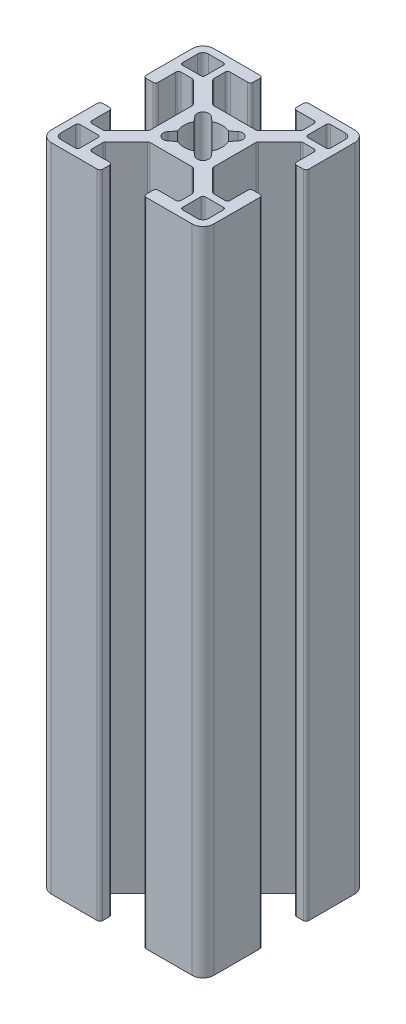
from build123d import *

# Parameters (mm, degrees)
PERFIL_COM_ALUMINIO_PERFIL_COMER_30_X_DEPTH = 120
DURCHGANGSLOCH_F_R_M51_D                    = 5.3
ESBO_O4_R                                   = 2.5
CORTE_EXTRUS_O1_DEPTH                       = 123.721924241


with BuildPart() as part:
    # Esboço1 → Perfil com. aluminio PERFIL COMER. 30 X 30(1) (new body)
    with BuildSketch(Plane(origin=(0, 0, 0), x_dir=(1, 0, 0), z_dir=(0, 1, 0))):
        with BuildLine():
            Line((0, 5.872725395), (-3.872893219, 5.872725395))
            ThreePointArc((-3.872893219, 5.872725395), (-4.064234935, 5.910785628), (-4.226446609, 6.019172004))
            Line((-4.226446609, 6.019172004), (-8.073553391, 9.866278785))
            ThreePointArc((-8.073553391, 9.866278785), (-8.181939766, 10.02849046), (-8.22, 10.219832176))
            Line((-8.22, 10.219832176), (-8.22, 12.25))
            ThreePointArc((-8.22, 12.25), (-8.073553391, 12.603553391), (-7.72, 12.75))
            Line((-7.72, 12.75), (-4.5, 12.75))
            ThreePointArc((-4.5, 12.75), (-4.146446609, 12.896446609), (-4, 13.25))
            Line((-4, 13.25), (-4, 14.5))
            ThreePointArc((-4, 14.5), (-4.146446609, 14.853553391), (-4.5, 15))
            Line((-4.5, 15), (-13, 15))
            ThreePointArc((-13, 15), (-14.414213562, 14.414213562), (-15, 13))
            Line((-15, 13), (-15, 4.5))
            ThreePointArc((-15, 4.5), (-14.853553391, 4.146446609), (-14.5, 4))
            Line((-14.5, 4), (-13.25, 4))
            ThreePointArc((-13.25, 4), (-12.896446609, 4.146446609), (-12.75, 4.5))
            Line((-12.75, 4.5), (-12.75, 7.72))
            ThreePointArc((-12.75, 7.72), (-12.603553391, 8.073553391), (-12.25, 8.22))
            Line((-12.25, 8.22), (-10.219832176, 8.22))
            ThreePointArc((-10.219832176, 8.22), (-10.02849046, 8.181939766), (-9.866278785, 8.073553391))
            Line((-9.866278785, 8.073553391), (-6.019172004, 4.226446609))
            ThreePointArc((-6.019172004, 4.226446609), (-5.910785628, 4.064234935), (-5.872725395, 3.872893219))
            Line((-5.872725395, 3.872893219), (-5.872725395, 0))
            Line((-5.872725395, 0), (-5.872725395, -3.872893219))
            ThreePointArc((-5.872725395, -3.872893219), (-5.910785628, -4.064234935), (-6.019172004, -4.226446609))
            Line((-6.019172004, -4.226446609), (-9.866278785, -8.073553391))
            ThreePointArc((-9.866278785, -8.073553391), (-10.02849046, -8.181939766), (-10.219832176, -8.22))
            Line((-10.219832176, -8.22), (-12.25, -8.22))
            ThreePointArc((-12.25, -8.22), (-12.603553391, -8.073553391), (-12.75, -7.72))
            Line((-12.75, -7.72), (-12.75, -4.5))
            ThreePointArc((-12.75, -4.5), (-12.896446609, -4.146446609), (-13.25, -4))
            Line((-13.25, -4), (-14.5, -4))
            ThreePointArc((-14.5, -4), (-14.853553391, -4.146446609), (-15, -4.5))
            Line((-15, -4.5), (-15, -13))
            ThreePointArc((-15, -13), (-14.414213562, -14.414213562), (-13, -15))
            Line((-13, -15), (-4.5, -15))
            ThreePointArc((-4.5, -15), (-4.146446609, -14.853553391), (-4, -14.5))
            Line((-4, -14.5), (-4, -13.25))
            ThreePointArc((-4, -13.25), (-4.146446609, -12.896446609), (-4.5, -12.75))
            Line((-4.5, -12.75), (-7.72, -12.75))
            ThreePointArc((-7.72, -12.75), (-8.073553391, -12.603553391), (-8.22, -12.25))
            Line((-8.22, -12.25), (-8.22, -10.219832176))
            ThreePointArc((-8.22, -10.219832176), (-8.181939766, -10.02849046), (-8.073553391, -9.866278785))
            Line((-8.073553391, -9.866278785), (-4.226446609, -6.019172004))
            ThreePointArc((-4.226446609, -6.019172004), (-4.064234935, -5.910785628), (-3.872893219, -5.872725395))
            Line((-3.872893219, -5.872725395), (0, -5.872725395))
            Line((0, -5.872725395), (3.872893219, -5.872725395))
            ThreePointArc((3.872893219, -5.872725395), (4.064234935, -5.910785628), (4.226446609, -6.019172004))
            Line((4.226446609, -6.019172004), (8.073553391, -9.866278785))
            ThreePointArc((8.073553391, -9.866278785), (8.181939766, -10.02849046), (8.22, -10.219832176))
            Line((8.22, -10.219832176), (8.22, -12.25))
            ThreePointArc((8.22, -12.25), (8.073553391, -12.603553391), (7.72, -12.75))
            Line((7.72, -12.75), (4.5, -12.75))
            ThreePointArc((4.5, -12.75), (4.146446609, -12.896446609), (4, -13.25))
            Line((4, -13.25), (4, -14.5))
            ThreePointArc((4, -14.5), (4.146446609, -14.853553391), (4.5, -15))
            Line((4.5, -15), (13, -15))
            ThreePointArc((13, -15), (14.414213562, -14.414213562), (15, -13))
            Line((15, -13), (15, -4.5))
            ThreePointArc((15, -4.5), (14.853553391, -4.146446609), (14.5, -4))
            Line((14.5, -4), (13.25, -4))
            ThreePointArc((13.25, -4), (12.896446609, -4.146446609), (12.75, -4.5))
            Line((12.75, -4.5), (12.75, -7.72))
            ThreePointArc((12.75, -7.72), (12.603553391, -8.073553391), (12.25, -8.22))
            Line((12.25, -8.22), (10.219832176, -8.22))
            ThreePointArc((10.219832176, -8.22), (10.02849046, -8.181939766), (9.866278785, -8.073553391))
            Line((9.866278785, -8.073553391), (6.019172004, -4.226446609))
            ThreePointArc((6.019172004, -4.226446609), (5.910785628, -4.064234935), (5.872725395, -3.872893219))
            Line((5.872725395, -3.872893219), (5.872725395, 0))
            Line((5.872725395, 0), (5.872725395, 3.872893219))
            ThreePointArc((5.872725395, 3.872893219), (5.910785628, 4.064234935), (6.019172004, 4.226446609))
            Line((6.019172004, 4.226446609), (9.866278785, 8.073553391))
            ThreePointArc((9.866278785, 8.073553391), (10.02849046, 8.181939766), (10.219832176, 8.22))
            Line((10.219832176, 8.22), (12.25, 8.22))
            ThreePointArc((12.25, 8.22), (12.603553391, 8.073553391), (12.75, 7.72))
            Line((12.75, 7.72), (12.75, 4.5))
            ThreePointArc((12.75, 4.5), (12.896446609, 4.146446609), (13.25, 4))
            Line((13.25, 4), (14.5, 4))
            ThreePointArc((14.5, 4), (14.853553391, 4.146446609), (15, 4.5))
            Line((15, 4.5), (15, 13))
            ThreePointArc((15, 13), (14.414213562, 14.414213562), (13, 15))
            Line((13, 15), (4.5, 15))
            ThreePointArc((4.5, 15), (4.146446609, 14.853553391), (4, 14.5))
            Line((4, 14.5), (4, 13.25))
            ThreePointArc((4, 13.25), (4.146446609, 12.896446609), (4.5, 12.75))
            Line((4.5, 12.75), (7.72, 12.75))
            ThreePointArc((7.72, 12.75), (8.073553391, 12.603553391), (8.22, 12.25))
            Line((8.22, 12.25), (8.22, 10.219832176))
            ThreePointArc((8.22, 10.219832176), (8.181939766, 10.02849046), (8.073553391, 9.866278785))
            Line((8.073553391, 9.866278785), (4.226446609, 6.019172004))
            ThreePointArc((4.226446609, 6.019172004), (4.064234935, 5.910785628), (3.872893219, 5.872725395))
            Line((3.872893219, 5.872725395), (0, 5.872725395))
        make_face()
        with BuildLine():
            Line((-3.184880899, 1.488031667), (-3.963428512, 2.463089418))
            ThreePointArc((-3.963428512, 2.463089418), (-3.884059164, 3.884060276), (-2.463088274, 3.963429046))
            Line((-2.463088274, 3.963429046), (-1.488030524, 3.184881434))
            ThreePointArc((-1.488030524, 3.184881434), (-0.762142411, 3.431740598), (6.31e-07, 3.515352697))
            ThreePointArc((6.31e-07, 3.515352697), (0.762143643, 3.431740324), (1.488031667, 3.184880899))
            Line((1.488031667, 3.184880899), (2.463089418, 3.963428512))
            ThreePointArc((2.463089418, 3.963428512), (3.884060276, 3.884059164), (3.963429046, 2.463088274))
            Line((3.963429046, 2.463088274), (3.184881434, 1.488030524))
            ThreePointArc((3.184881434, 1.488030524), (3.431740598, 0.762142411), (3.515352697, -6.31e-07))
            ThreePointArc((3.515352697, -6.31e-07), (3.431740324, -0.762143643), (3.184880899, -1.488031667))
            Line((3.184880899, -1.488031667), (3.963428512, -2.463089418))
            ThreePointArc((3.963428512, -2.463089418), (3.884059164, -3.884060276), (2.463088274, -3.963429046))
            Line((2.463088274, -3.963429046), (1.488030524, -3.184881434))
            ThreePointArc((1.488030524, -3.184881434), (0.762142411, -3.431740598), (-6.31e-07, -3.515352697))
            ThreePointArc((-6.31e-07, -3.515352697), (-0.762143643, -3.431740324), (-1.488031667, -3.184880899))
            Line((-1.488031667, -3.184880899), (-2.463089418, -3.963428512))
            ThreePointArc((-2.463089418, -3.963428512), (-3.884060276, -3.884059164), (-3.963429046, -2.463088274))
            Line((-3.963429046, -2.463088274), (-3.184881434, -1.488030524))
            ThreePointArc((-3.184881434, -1.488030524), (-3.431740598, -0.762142411), (-3.515352697, 6.31e-07))
            ThreePointArc((-3.515352697, 6.31e-07), (-3.431740324, 0.762143643), (-3.184880899, 1.488031667))
        make_face(mode=Mode.SUBTRACT)
        with BuildLine():
            Line((-9.46, 13.26), (-9.46, 9.84))
            ThreePointArc((-9.46, 9.84), (-9.571299423, 9.571299423), (-9.84, 9.46))
            Line((-9.84, 9.46), (-13.26, 9.46))
            ThreePointArc((-13.26, 9.46), (-13.528700577, 9.571299423), (-13.64, 9.84))
            Line((-13.64, 9.84), (-13.64, 12.64))
            ThreePointArc((-13.64, 12.64), (-13.347106781, 13.347106781), (-12.64, 13.64))
            Line((-12.64, 13.64), (-9.84, 13.64))
            ThreePointArc((-9.84, 13.64), (-9.571299423, 13.528700577), (-9.46, 13.26))
        make_face(mode=Mode.SUBTRACT)
        with BuildLine():
            Line((13.64, 12.64), (13.64, 9.84))
            ThreePointArc((13.64, 9.84), (13.528700577, 9.571299423), (13.26, 9.46))
            Line((13.26, 9.46), (9.84, 9.46))
            ThreePointArc((9.84, 9.46), (9.571299423, 9.571299423), (9.46, 9.84))
            Line((9.46, 9.84), (9.46, 13.26))
            ThreePointArc((9.46, 13.26), (9.571299423, 13.528700577), (9.84, 13.64))
            Line((9.84, 13.64), (12.64, 13.64))
            ThreePointArc((12.64, 13.64), (13.347106781, 13.347106781), (13.64, 12.64))
        make_face(mode=Mode.SUBTRACT)
        with BuildLine():
            Line((12.64, -13.64), (9.84, -13.64))
            ThreePointArc((9.84, -13.64), (9.571299423, -13.528700577), (9.46, -13.26))
            Line((9.46, -13.26), (9.46, -9.84))
            ThreePointArc((9.46, -9.84), (9.571299423, -9.571299423), (9.84, -9.46))
            Line((9.84, -9.46), (13.26, -9.46))
            ThreePointArc((13.26, -9.46), (13.528700577, -9.571299423), (13.64, -9.84))
            Line((13.64, -9.84), (13.64, -12.64))
            ThreePointArc((13.64, -12.64), (13.347106781, -13.347106781), (12.64, -13.64))
        make_face(mode=Mode.SUBTRACT)
        with BuildLine():
            Line((-13.64, -12.64), (-13.64, -9.84))
            ThreePointArc((-13.64, -9.84), (-13.528700577, -9.571299423), (-13.26, -9.46))
            Line((-13.26, -9.46), (-9.84, -9.46))
            ThreePointArc((-9.84, -9.46), (-9.571299423, -9.571299423), (-9.46, -9.84))
            Line((-9.46, -9.84), (-9.46, -13.26))
            ThreePointArc((-9.46, -13.26), (-9.571299423, -13.528700577), (-9.84, -13.64))
            Line((-9.84, -13.64), (-12.64, -13.64))
            ThreePointArc((-12.64, -13.64), (-13.347106781, -13.347106781), (-13.64, -12.64))
        make_face(mode=Mode.SUBTRACT)
    extrude(amount=PERFIL_COM_ALUMINIO_PERFIL_COMER_30_X_DEPTH)

    # Durchgangsloch für M51 (through all)
    with Locations(Plane(origin=(0, 90, 5.872725395), x_dir=(1, 0, 0), z_dir=(0, 0, 1))):
        with Locations((0, 0), (0, -50)):
            Hole(DURCHGANGSLOCH_F_R_M51_D / 2)

    # Esboço4 → Corte-extrusão1 (cut, through all)
    with BuildSketch(Plane(origin=(5.872725395, 0, 0), x_dir=(0, 0, -1), z_dir=(1, 0, 0))):
        with Locations((0, 90)):
            Circle(ESBO_O4_R)
        with Locations((0, 40)):
            Circle(ESBO_O4_R)
    extrude(amount=-CORTE_EXTRUS_O1_DEPTH, mode=Mode.SUBTRACT)


solid = part.part
